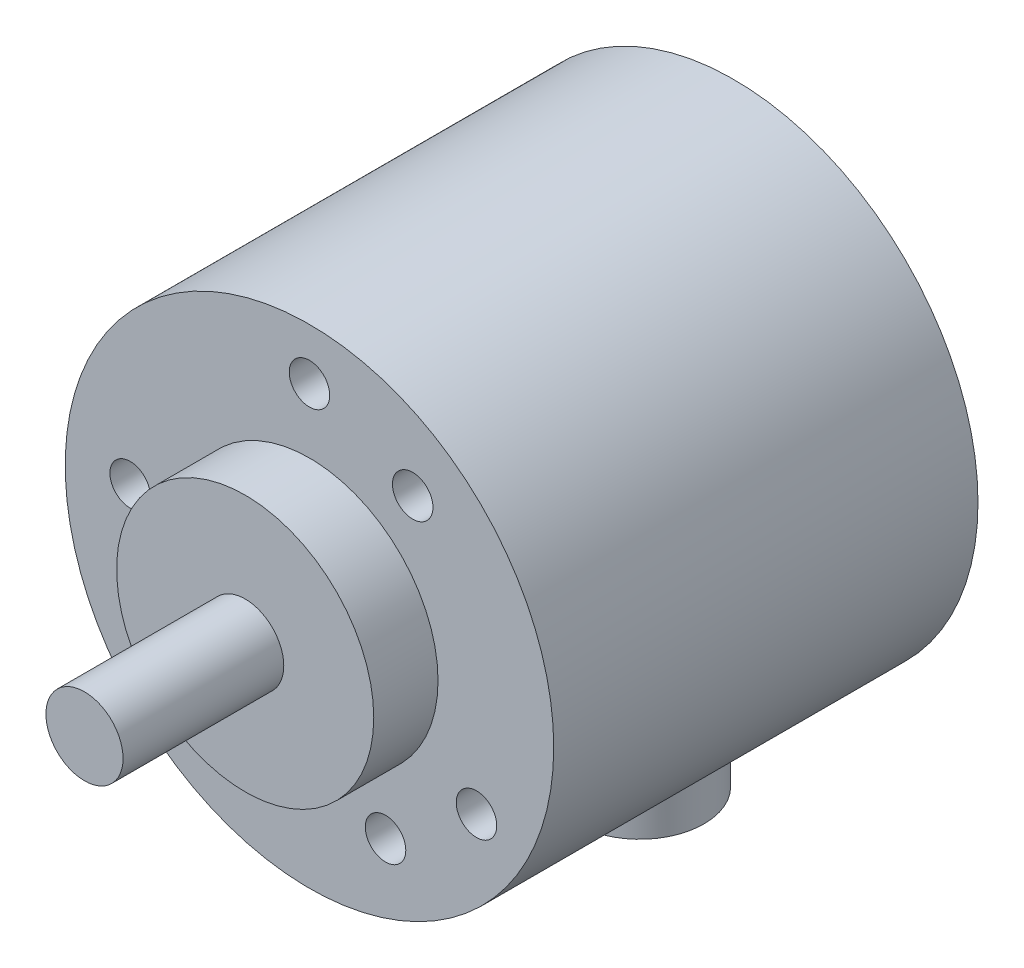
from build123d import *

# Parameters (mm, degrees)
SKETCH2_R           = 19
BOSS_EXTRUDE1_DEPTH = 33
SKETCH2_3_R         = 10
SKETCH2_3_R_2       = 3
BOSS_EXTRUDE2_DEPTH = 5
SKETCH2_4_R         = 3
BOSS_EXTRUDE3_DEPTH = 17.5
SKETCH4_R           = 5
BOSS_EXTRUDE4_DEPTH = 25
SKETCH5_R           = 1.575
CUT_EXTRUDE1_DEPTH  = 6


with BuildPart() as part:
    # Sketch2 → Boss-Extrude1 (new body)
    with BuildSketch(Plane.XY):
        Circle(SKETCH2_R)
    extrude(amount=-BOSS_EXTRUDE1_DEPTH)

    # Sketch2<3> → Boss-Extrude2 (add)
    with BuildSketch(Plane.XY):
        Circle(SKETCH2_3_R)
        Circle(SKETCH2_3_R_2, mode=Mode.SUBTRACT)
    extrude(amount=BOSS_EXTRUDE2_DEPTH)

    # Sketch2<4> → Boss-Extrude3 (add)
    with BuildSketch(Plane.XY):
        Circle(SKETCH2_4_R)
    extrude(amount=BOSS_EXTRUDE3_DEPTH)

    # Sketch4 → Boss-Extrude4 (add)
    with BuildSketch(Plane(origin=(0, 0, 0), x_dir=(1, 0, 0), z_dir=(0, 1, 0))):
        with Locations((0, 25.688557627)):
            Circle(SKETCH4_R)
    extrude(amount=-BOSS_EXTRUDE4_DEPTH)

    # Sketch5 → Cut-Extrude1 (cut)
    with BuildSketch(Plane.XY):
        with Locations((0, 15)):
            Circle(SKETCH5_R)
        with Locations((12.990381057, -7.5)):
            Circle(SKETCH5_R)
        with Locations((-12.990381057, -7.5)):
            Circle(SKETCH5_R)
        with Locations((8.030070109, 11.46812862)):
            Circle(SKETCH5_R)
        with Locations((5.916655664, -12.688309019)):
            Circle(SKETCH5_R)
        with Locations((-13.946725773, 1.220180398)):
            Circle(SKETCH5_R)
    extrude(amount=-CUT_EXTRUDE1_DEPTH, mode=Mode.SUBTRACT)


solid = part.part
